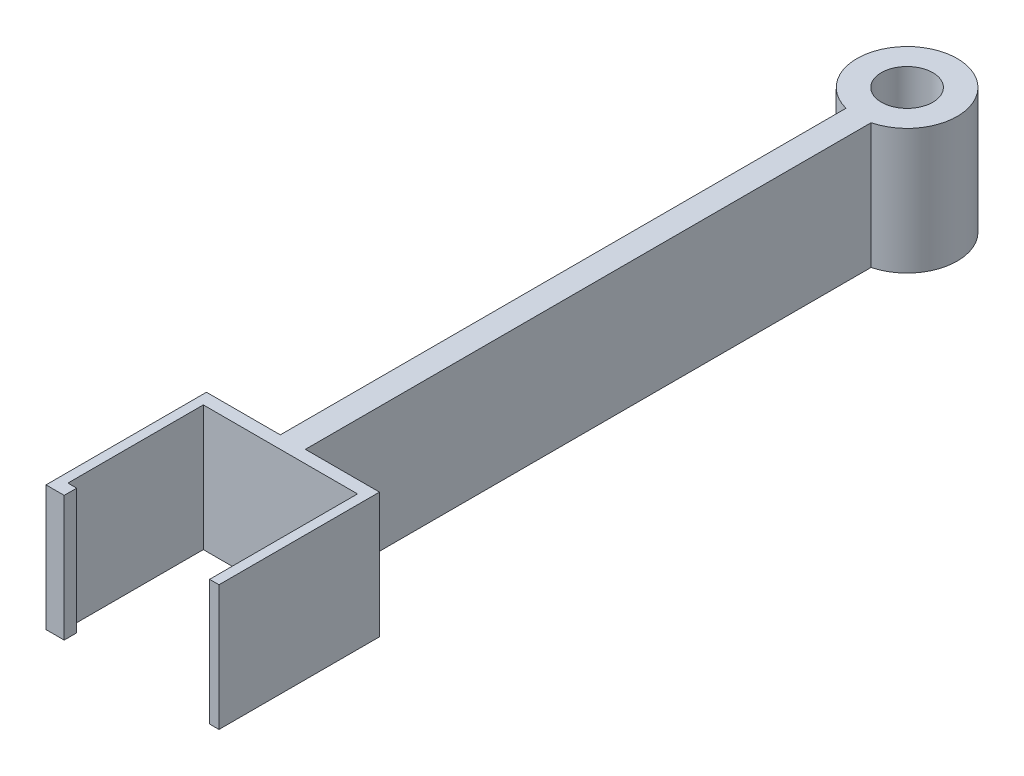
from build123d import *

# Parameters (mm, degrees)
SKETCH3_W           = 13.8
SKETCH3_H           = 12.8
BOSS_EXTRUDE2_DEPTH = 10
SKETCH4_W           = 12.3
SKETCH4_H           = 10.8
CUT_EXTRUDE1_DEPTH  = 10
SKETCH5_W           = 11.5990209
SKETCH5_H           = 6.4
CUT_EXTRUDE2_DEPTH  = 10
SKETCH10_W          = 2
SKETCH10_H          = 50
BOSS_EXTRUDE5_DEPTH = 10
SKETCH12_R          = 4
BOSS_EXTRUDE6_DEPTH = 10
SKETCH13_R          = 2.05
CUT_EXTRUDE4_DEPTH  = 10


with BuildPart() as part:
    # Sketch3 → Boss-Extrude2 (new body)
    with BuildSketch(Plane(origin=(0, 0, 0), x_dir=(1, 0, 0), z_dir=(0, 1, 0))):
        Rectangle(SKETCH3_W, SKETCH3_H)
    extrude(amount=BOSS_EXTRUDE2_DEPTH)

    # Sketch4 → Cut-Extrude1 (cut)
    with BuildSketch(Plane(origin=(0, 0, 0), x_dir=(1, 0, 0), z_dir=(0, 1, 0))):
        Rectangle(SKETCH4_W, SKETCH4_H)
    extrude(amount=CUT_EXTRUDE1_DEPTH, mode=Mode.SUBTRACT)

    # Sketch5 → Cut-Extrude2 (cut)
    with BuildSketch(Plane(origin=(0, 0, 0), x_dir=(1, 0, 0), z_dir=(0, 1, 0))):
        with Locations((0.35048955, -3.2)):
            Rectangle(SKETCH5_W, SKETCH5_H)
    extrude(amount=CUT_EXTRUDE2_DEPTH, mode=Mode.SUBTRACT)

    # Sketch10 → Boss-Extrude5 (add)
    with BuildSketch(Plane(origin=(0, 0, 0), x_dir=(1, 0, 0), z_dir=(0, 1, 0))):
        with Locations((-0.009485453, 30.4)):
            Rectangle(SKETCH10_W, SKETCH10_H)
    extrude(amount=BOSS_EXTRUDE5_DEPTH)

    # Sketch12 → Boss-Extrude6 (add)
    with BuildSketch(Plane(origin=(0, 0, 0), x_dir=(1, 0, 0), z_dir=(0, 1, 0))):
        with Locations((-0.009485453, 55.4)):
            Circle(SKETCH12_R)
    extrude(amount=BOSS_EXTRUDE6_DEPTH)

    # Sketch13 → Cut-Extrude4 (cut)
    with BuildSketch(Plane(origin=(0, 0, 0), x_dir=(1, 0, 0), z_dir=(0, 1, 0))):
        with Locations(Location((-0.009485453, 55.4, 0), (0, 0, 270))):
            Circle(SKETCH13_R)
    extrude(amount=CUT_EXTRUDE4_DEPTH, mode=Mode.SUBTRACT)


solid = part.part
